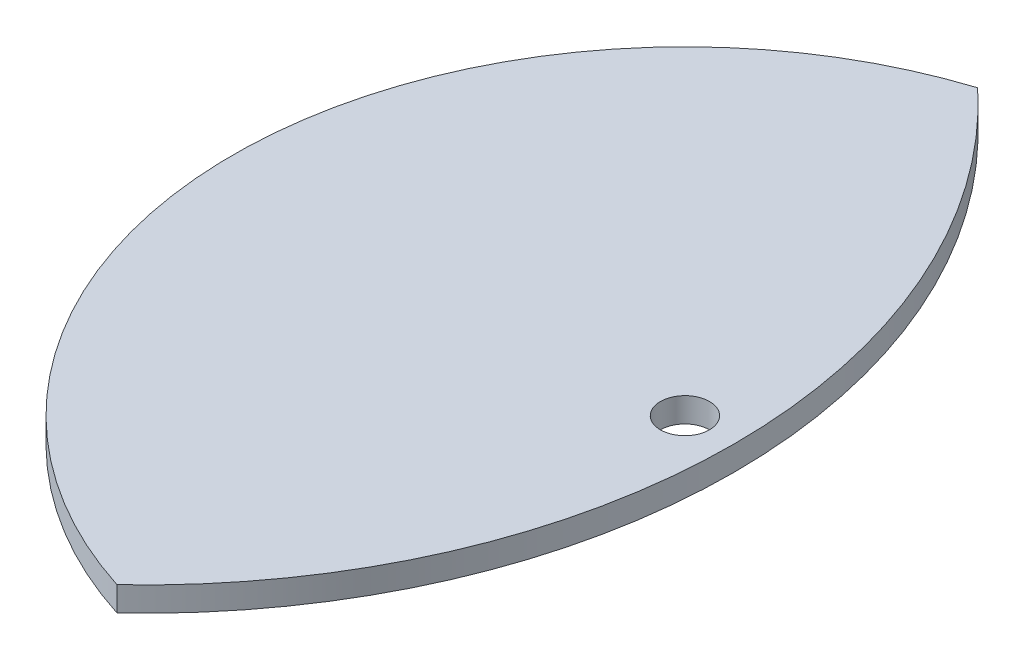
from build123d import *

# Parameters (mm, degrees)
SKETCH1_R           = 3.175
BOSS_EXTRUDE1_DEPTH = 3.175


with BuildPart() as part:
    # Sketch1 → Boss-Extrude1 (new body)
    with BuildSketch(Plane(origin=(0, 0, 0), x_dir=(1, 0, 0), z_dir=(0, 1, 0))):
        with BuildLine():
            ThreePointArc((76.2, 0), (69.904557206, 30.328087342), (52.058454545, 55.644921694))
            ThreePointArc((52.058454545, 55.644921694), (11.43, 0), (52.058454545, -55.644921694))
            ThreePointArc((52.058454545, -55.644921694), (69.904557206, -30.328087342), (76.2, 0))
        make_face()
        with Locations(Location((69.85, 0, 0), (0, 0, 270))):
            Circle(SKETCH1_R, mode=Mode.SUBTRACT)
    extrude(amount=BOSS_EXTRUDE1_DEPTH)


solid = part.part
